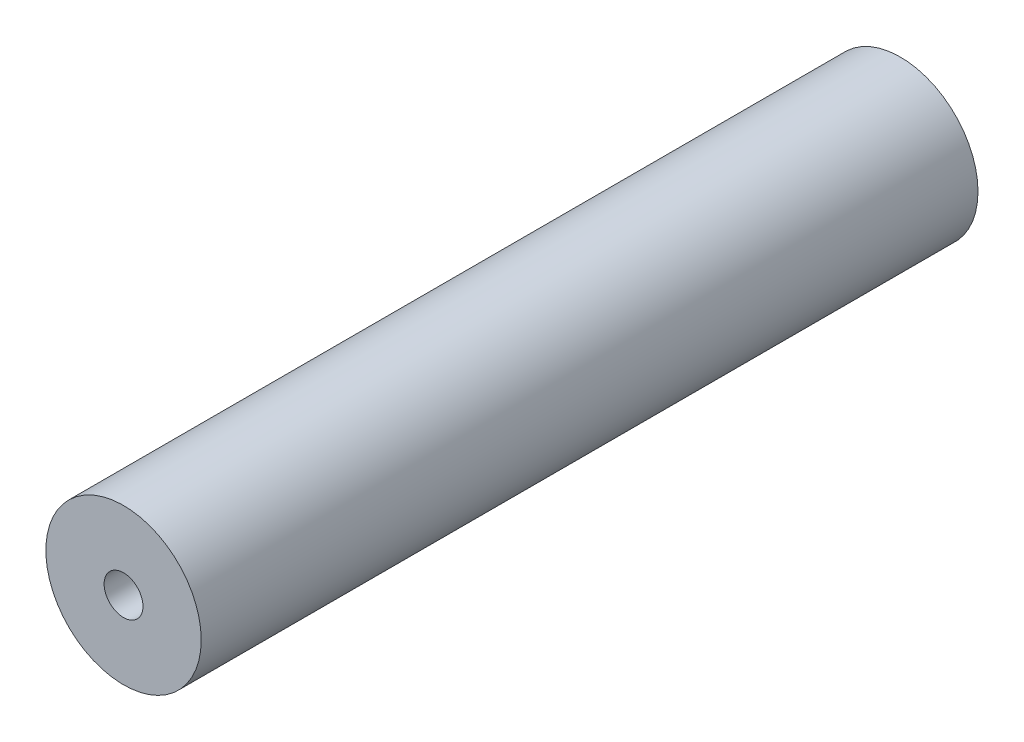
from build123d import *

# Parameters (mm, degrees)
SKETCH1_R           = 25.4
BOSS_EXTRUDE1_DEPTH = 254
SKETCH2_R           = 6.35
CUT_EXTRUDE1_DEPTH  = 257.527425434


with BuildPart() as part:
    # Sketch1 → Boss-Extrude1 (new body)
    with BuildSketch(Plane.XY):
        Circle(SKETCH1_R)
    extrude(amount=BOSS_EXTRUDE1_DEPTH)

    # Sketch2 → Cut-Extrude1 (cut, through all)
    with BuildSketch(Plane.XY.offset(254)):
        Circle(SKETCH2_R)
    extrude(amount=-CUT_EXTRUDE1_DEPTH, mode=Mode.SUBTRACT)


solid = part.part
